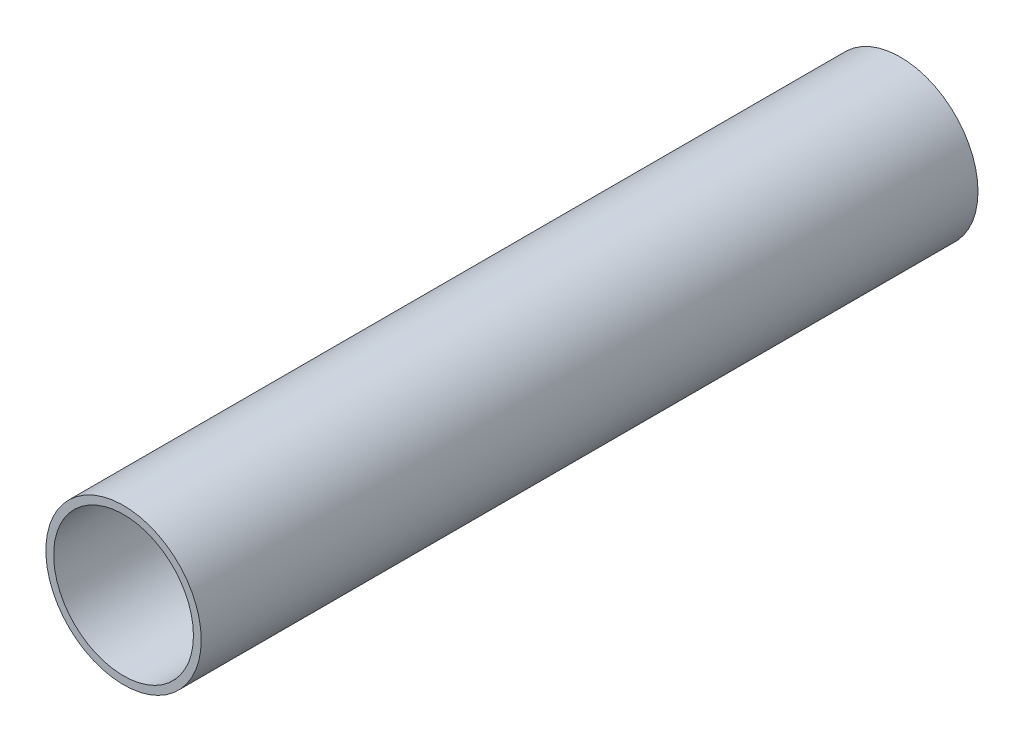
from build123d import *

# Parameters (mm, degrees)
SKETCH1_R           = 50
SKETCH1_R_2         = 45
BOSS_EXTRUDE1_DEPTH = 500


with BuildPart() as part:
    # Sketch1 → Boss-Extrude1 (new body)
    with BuildSketch(Plane.XY):
        Circle(SKETCH1_R)
        Circle(SKETCH1_R_2, mode=Mode.SUBTRACT)
    extrude(amount=BOSS_EXTRUDE1_DEPTH)


solid = part.part
